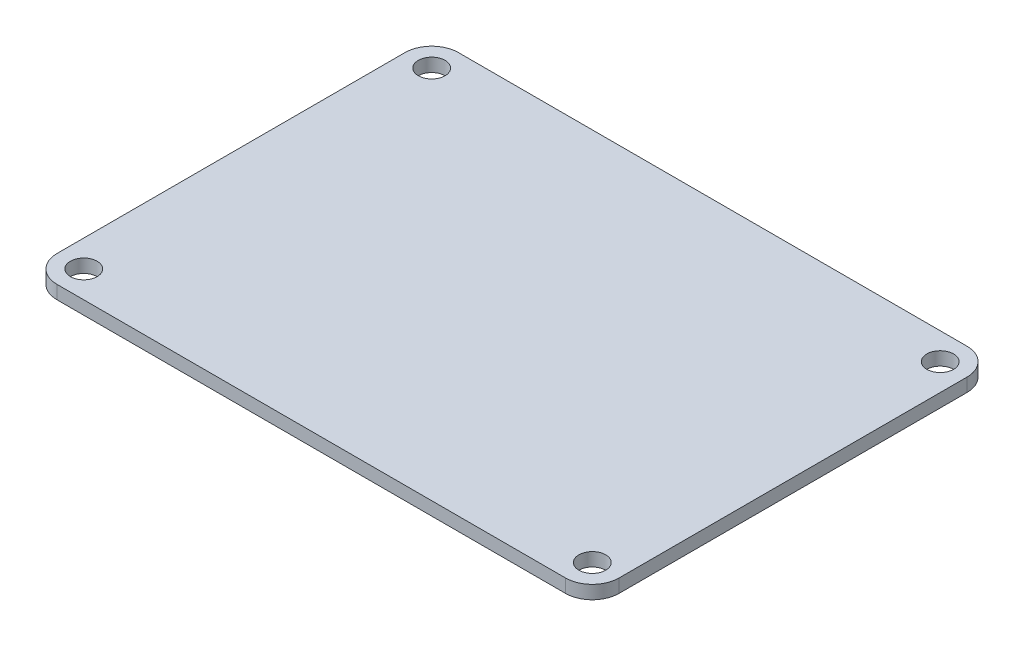
from build123d import *

# Parameters (mm, degrees)
SKETCH_1_W          = 63
SKETCH_1_H          = 45
EXTRUDE_1_DEPTH     = 1.5
FILLET_1_R          = 3
SKETCH_2_R          = 1.5
CUT_EXTRUDE_1_DEPTH = 39.73951471


with BuildPart() as part:
    # Эскиз1 → Бобышка-Вытянуть1 (new body)
    with BuildSketch(Plane(origin=(0, 0, 0), x_dir=(1, 0, 0), z_dir=(0, 1, 0))):
        Rectangle(SKETCH_1_W, SKETCH_1_H)
    extrude(amount=EXTRUDE_1_DEPTH)

    # Скругление1
    fillet_1_edges = [part.edges().sort_by_distance(p)[0] for p in [
        (-31.5, 0.75, -22.5),
        (31.5, 0.75, -22.5),
        (31.5, 0.75, 22.5),
        (-31.5, 0.75, 22.5),
    ]]
    fillet(fillet_1_edges, radius=FILLET_1_R)

    # Эскиз2 → Вырез-Вытянуть1 (cut, through all)
    with BuildSketch(Plane(origin=(0, 1.5, 0), x_dir=(1, 0, 0), z_dir=(0, 1, 0))):
        with Locations(Location((-28.5, 19.5, 0), (0, 0, 270))):
            Circle(SKETCH_2_R)
        with Locations(Location((28.5, 19.5, 0), (0, 0, 270))):
            Circle(SKETCH_2_R)
        with Locations(Location((28.5, -19.5, 0), (0, 0, 270))):
            Circle(SKETCH_2_R)
        with Locations(Location((-28.5, -19.5, 0), (0, 0, 270))):
            Circle(SKETCH_2_R)
    extrude(amount=-CUT_EXTRUDE_1_DEPTH, mode=Mode.SUBTRACT)


solid = part.part
